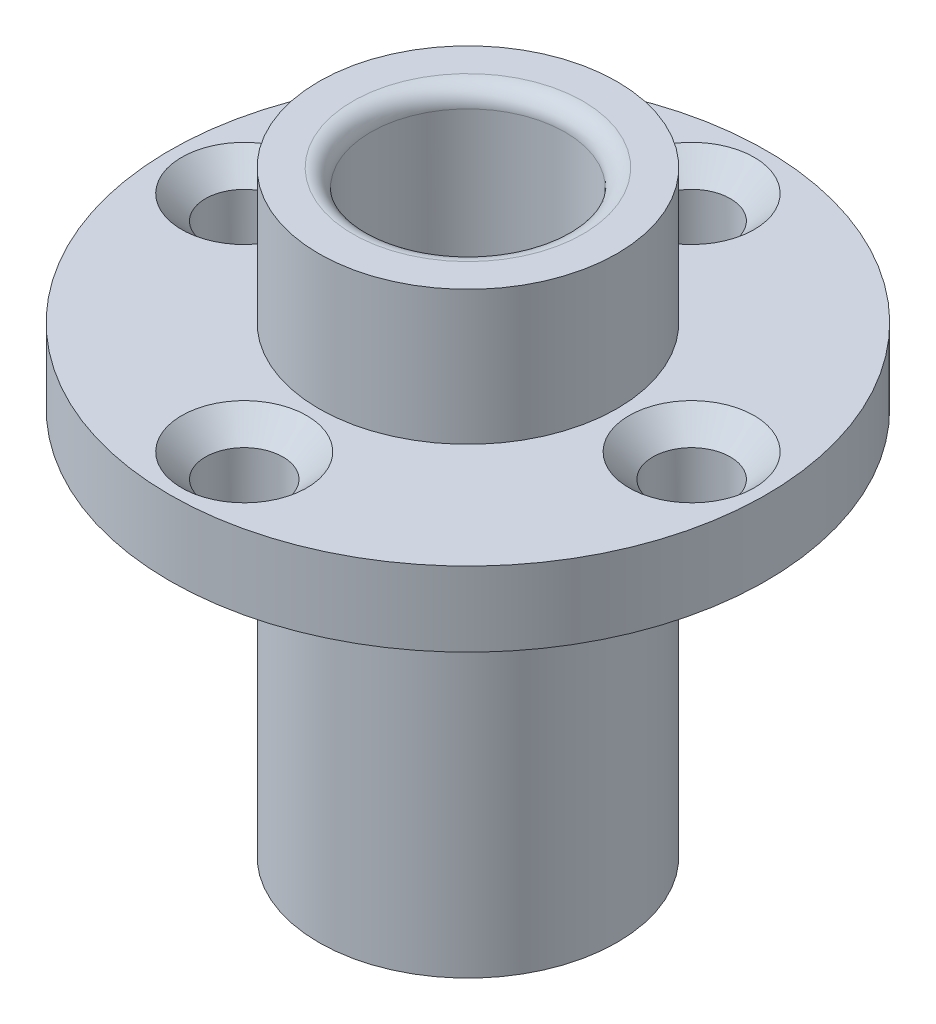
from build123d import *

# Parameters (mm, degrees)
SKETCH2_R                    = 1.65
CUT_EXTRUDE1_DEPTH           = 27.647311778
CHAMFER1_SIZE                = 1.016
CIRPATTERN1_COUNT            = 4
CHAMFER1_OF_CIRPATTERN1_SIZE = 1.016
FILLET1_R                    = 0.762


with BuildPart() as part:
    # Sketch1 → Revolve1 (revolve)
    with BuildSketch(Plane.XY, mode=Mode.PRIVATE) as revolve1_sk:
        Polygon((4.1402, 12.7), (4.1402, -12.7), (6.35, -12.7), (6.35, 3.81), (12.7, 3.81), (12.7, 6.985), (6.35, 6.985), (6.35, 12.7), align=None)
    revolve(revolve1_sk.sketch.rotate(Axis((0, 0, 0), (0, -1, 0)), 90), axis=Axis((0, 0, 0), (0, -1, 0)))

    # Sketch2 → Cut-Extrude1 (cut, through all)
    with BuildSketch(Plane(origin=(0, 6.985, 0), x_dir=(1, 0, 0), z_dir=(0, 1, 0))):
        with Locations(Location((0, 9.525, 0), (0, 0, 270))):
            Circle(SKETCH2_R)
    cut_extrude1 = extrude(amount=-CUT_EXTRUDE1_DEPTH, mode=Mode.SUBTRACT)

    # Chamfer1
    chamfer1_edges = [part.edges().sort_by_distance(p)[0] for p in [
        (0, 6.985, -11.175),
    ]]
    chamfer(chamfer1_edges, length=CHAMFER1_SIZE)

    # CirPattern1: Cut-Extrude1 ×4 about axis
    cirpattern1_axis = Axis((0, 0, 0), (0, 1, 0))
    for i in range(1, CIRPATTERN1_COUNT):
        add(cut_extrude1.rotate(cirpattern1_axis, i * 360 / CIRPATTERN1_COUNT), mode=Mode.SUBTRACT)

    # Chamfer1 of CirPattern1
    chamfer1_of_cirpattern1_edges = [part.edges().sort_by_distance(p)[0] for p in [
        (-11.175, 6.985, 0),
        (0, 6.985, 11.175),
        (11.175, 6.985, 0),
    ]]
    chamfer(chamfer1_of_cirpattern1_edges, length=CHAMFER1_OF_CIRPATTERN1_SIZE)

    # Fillet1
    fillet1_edges = [part.edges().sort_by_distance(p)[0] for p in [
        (0, 12.7, -4.1402),
        (0, -12.7, -4.1402),
    ]]
    fillet(fillet1_edges, radius=FILLET1_R)


solid = part.part
